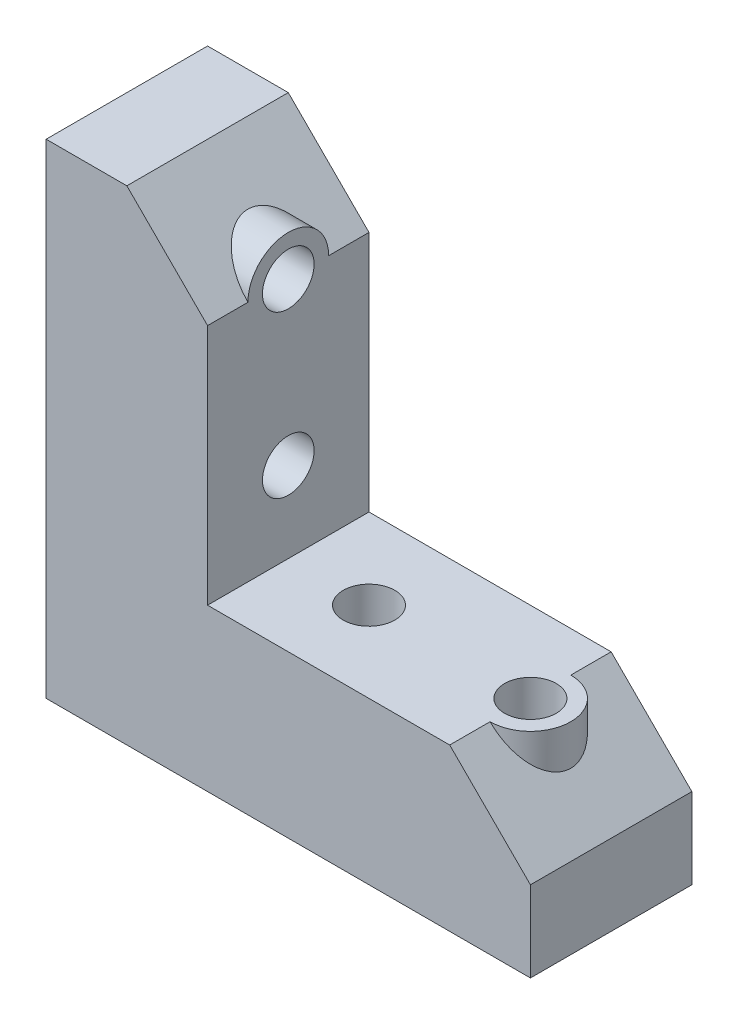
from build123d import *

# Parameters (mm, degrees)
AUFSATZ_LINEAR_AUSTRAGEN1_DEPTH = 10
FASE1_SIZE                      = 5
SKIZZE2_R                       = 1.6
SCHNITT_LINEAR_AUSTRAGEN1_DEPTH = 10
SKIZZE3_R                       = 2.5
SKIZZE3_R_2                     = 1.6
AUFSATZ_LINEAR_AUSTRAGEN2_DEPTH = 10
SKIZZE5_R                       = 2.5
SKIZZE5_R_2                     = 1.6
AUFSATZ_LINEAR_AUSTRAGEN3_DEPTH = 10
SKIZZE4_R                       = 1.6
SCHNITT_LINEAR_AUSTRAGEN3_DEPTH = 10


with BuildPart() as part:
    # Skizze1 → Aufsatz-Linear austragen1 (new body)
    with BuildSketch(Plane.XY):
        Polygon((0, 30), (10, 30), (10, 10), (30, 10), (30, 0), (0, 0), align=None)
    extrude(amount=AUFSATZ_LINEAR_AUSTRAGEN1_DEPTH)

    # Fase1
    fase1_edges = [part.edges().sort_by_distance(p)[0] for p in [
        (10, 30, 5),
        (30, 10, 5),
    ]]
    chamfer(fase1_edges, length=FASE1_SIZE)

    # Skizze2 → Schnitt-Linear austragen1 (cut)
    with BuildSketch(Plane.ZY):
        with Locations((5, 15)):
            Circle(SKIZZE2_R)
        with Locations((5, 25)):
            Circle(SKIZZE2_R)
    extrude(amount=-SCHNITT_LINEAR_AUSTRAGEN1_DEPTH, mode=Mode.SUBTRACT)

    # Skizze3 → Aufsatz-Linear austragen2 (add)
    with BuildSketch(Plane.ZY):
        with Locations((5, 25)):
            Circle(SKIZZE3_R)
        with Locations((5, 25)):
            Circle(SKIZZE3_R_2, mode=Mode.SUBTRACT)
    extrude(amount=-AUFSATZ_LINEAR_AUSTRAGEN2_DEPTH)

    # Skizze5 → Aufsatz-Linear austragen3 (add)
    with BuildSketch(Plane.XZ):
        with Locations((25, 5)):
            Circle(SKIZZE5_R)
        with Locations((25, 5)):
            Circle(SKIZZE5_R_2, mode=Mode.SUBTRACT)
    extrude(amount=-AUFSATZ_LINEAR_AUSTRAGEN3_DEPTH)

    # Skizze4 → Schnitt-Linear austragen3 (cut)
    with BuildSketch(Plane.XZ):
        with Locations((15, 5)):
            Circle(SKIZZE4_R)
        with Locations((25, 5)):
            Circle(SKIZZE4_R)
    extrude(amount=-SCHNITT_LINEAR_AUSTRAGEN3_DEPTH, mode=Mode.SUBTRACT)


solid = part.part
